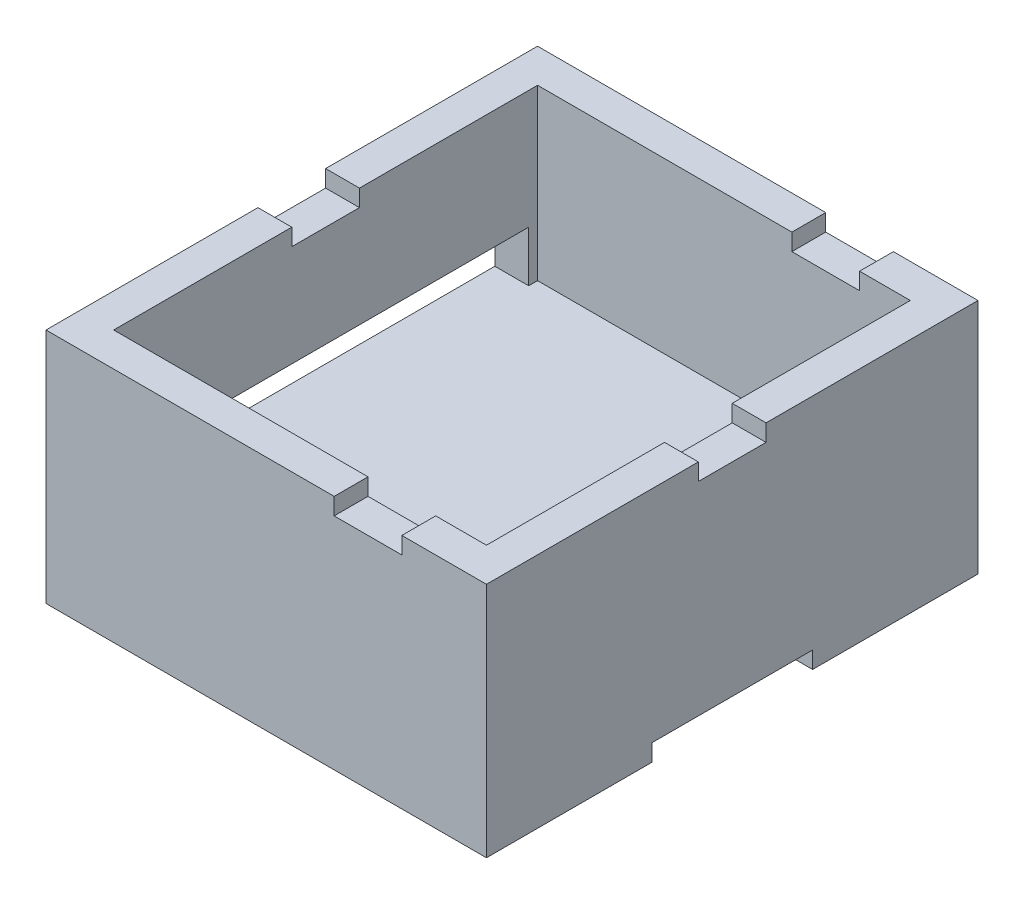
from build123d import *

# Parameters (mm, degrees)
SKETCH1_W           = 22.03
SKETCH1_H           = 25.05
SKETCH1_R           = 1.5
BOSS_EXTRUDE1_DEPTH = 4
SKETCH2_W           = 26.03
SKETCH2_H           = 29.05
SKETCH2_W_2         = 22.03
SKETCH2_H_2         = 25.05
BOSS_EXTRUDE3_DEPTH = 14
CUT_EXTRUDE1_DEPTH  = 5
CUT_EXTRUDE2_DEPTH  = 50
SKETCH5_W           = 4
SKETCH5_H           = 1
CUT_EXTRUDE3_DEPTH  = 50
CUT_EXTRUDE4_DEPTH  = 1


with BuildPart() as part:
    # Sketch1 → Boss-Extrude1 (new body)
    with BuildSketch(Plane(origin=(0, 0, 0), x_dir=(1, 0, 0), z_dir=(0, 1, 0))):
        with Locations((9.515, 11.025)):
            Rectangle(SKETCH1_W, SKETCH1_H)
        with Locations(Location((16.53, 2.5, 0), (0, 0, 270))):
            Circle(SKETCH1_R, mode=Mode.SUBTRACT)
        with Locations(Location((16.53, 19.55, 0), (0, 0, 270))):
            Circle(SKETCH1_R, mode=Mode.SUBTRACT)
    extrude(amount=BOSS_EXTRUDE1_DEPTH)

    # Sketch2 → Boss-Extrude3 (add)
    with BuildSketch(Plane.XZ):
        with Locations((9.515, -11.025)):
            Rectangle(SKETCH2_W, SKETCH2_H)
        with Locations((9.515, -11.025)):
            Rectangle(SKETCH2_W_2, SKETCH2_H_2, mode=Mode.SUBTRACT)
    extrude(amount=-BOSS_EXTRUDE3_DEPTH)

    # Sketch3 → Cut-Extrude1 (cut)
    with BuildSketch(Plane.ZY.offset(3.5)):
        Polygon((-11.025, 4), (-23.025, 4), (-23.025, 7), (0.975, 7), (0.975, 4), align=None)
    extrude(amount=-CUT_EXTRUDE1_DEPTH, mode=Mode.SUBTRACT)

    # Sketch4 → Cut-Extrude2 (cut)
    with BuildSketch(Plane.ZY.offset(3.5)):
        Polygon((-11.025, 14), (-13.025, 14), (-13.025, 13), (-9.025, 13), (-9.025, 14), align=None)
    extrude(amount=-CUT_EXTRUDE2_DEPTH, mode=Mode.SUBTRACT)

    # Sketch5 → Cut-Extrude3 (cut)
    with BuildSketch(Plane(origin=(0, 0, -25.55), x_dir=(-1, 0, 0), z_dir=(0, 0, -1))):
        with Locations((-15.53, 13.5)):
            Rectangle(SKETCH5_W, SKETCH5_H)
    extrude(amount=-CUT_EXTRUDE3_DEPTH, mode=Mode.SUBTRACT)

    # Sketch7 → Cut-Extrude4 (cut)
    with BuildSketch(Plane.XZ):
        Polygon((-3.5, -11.025), (-3.5, -6.275), (22.53, -6.275), (22.53, -15.775), (-3.5, -15.775), align=None)
    extrude(amount=-CUT_EXTRUDE4_DEPTH, mode=Mode.SUBTRACT)


solid = part.part
